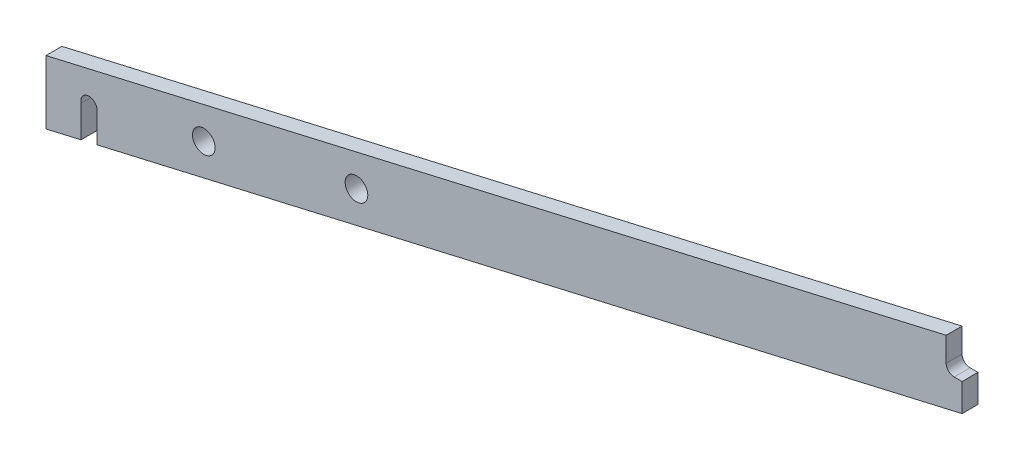
from build123d import *

# Parameters (mm, degrees)
BOSS_EXTRUDE1_DEPTH = 1.5875
CUT_EXTRUDE1_REACH  = 97.488
SKETCH2_R           = 1.1303


with BuildPart() as part:
    # Sketch1 → Boss-Extrude1 (new body)
    with BuildSketch(Plane.XY):
        Polygon((91.44, 21.110587397), (91.44, 27.460587397), (0, 6.35), (0, 0), align=None)
    extrude(amount=BOSS_EXTRUDE1_DEPTH)

    # Sketch2 → Cut-Extrude1 (cut, up to next)
    with BuildSketch(Plane.XY.offset(1.5875), mode=Mode.PRIVATE) as cut_extrude1_sk1:
        with BuildLine():
            Line((3.4925, 0.806307158), (5.08, 1.172810411))
            Line((5.08, 1.172810411), (5.08, 4.347810411))
            ThreePointArc((5.08, 4.347810411), (4.102998373, 4.958308784), (3.4925, 3.981307158))
            Line((3.4925, 3.981307158), (3.4925, 0.806307158))
        make_face()
    cut_extrude1_tool1 = extrude(cut_extrude1_sk1.sketch, amount=-CUT_EXTRUDE1_REACH, mode=Mode.PRIVATE) & part.part
    # Sketch2 → Cut-Extrude1 (cut, up to next)
    with BuildSketch(Plane.XY.offset(1.5875), mode=Mode.PRIVATE) as cut_extrude1_sk2:
        with BuildLine():
            Line((91.44, 23.888712397), (91.44, 27.460587397))
            Line((91.44, 27.460587397), (89.8525, 27.094084143))
            Line((89.8525, 27.094084143), (89.8525, 24.682462397))
            ThreePointArc((89.8525, 24.682462397), (90.084983992, 24.121196389), (90.64625, 23.888712397))
            Line((90.64625, 23.888712397), (91.44, 23.888712397))
        make_face()
    cut_extrude1_tool2 = extrude(cut_extrude1_sk2.sketch, amount=-CUT_EXTRUDE1_REACH, mode=Mode.PRIVATE) & part.part
    # Sketch2 → Cut-Extrude1 (cut, up to next)
    with BuildSketch(Plane.XY.offset(1.5875), mode=Mode.PRIVATE) as cut_extrude1_sk3:
        with Locations((15.748, 6.810712274)):
            Circle(SKETCH2_R)
    cut_extrude1_tool3 = extrude(cut_extrude1_sk3.sketch, amount=-CUT_EXTRUDE1_REACH, mode=Mode.PRIVATE) & part.part
    # Sketch2 → Cut-Extrude1 (cut, up to next)
    with BuildSketch(Plane.XY.offset(1.5875), mode=Mode.PRIVATE) as cut_extrude1_sk4:
        with Locations((30.988, 10.329143507)):
            Circle(SKETCH2_R)
    cut_extrude1_tool4 = extrude(cut_extrude1_sk4.sketch, amount=-CUT_EXTRUDE1_REACH, mode=Mode.PRIVATE) & part.part
    add(cut_extrude1_tool1.solids().sort_by_distance((4.272922, 2.906844, 1.5875))[0], mode=Mode.SUBTRACT)
    add(cut_extrude1_tool2.solids().sort_by_distance((90.676821, 25.62383, 1.5875))[0], mode=Mode.SUBTRACT)
    add(cut_extrude1_tool3.solids().sort_by_distance((15.748, 6.810712, 1.5875))[0], mode=Mode.SUBTRACT)
    add(cut_extrude1_tool4.solids().sort_by_distance((30.988, 10.329144, 1.5875))[0], mode=Mode.SUBTRACT)


solid = part.part
